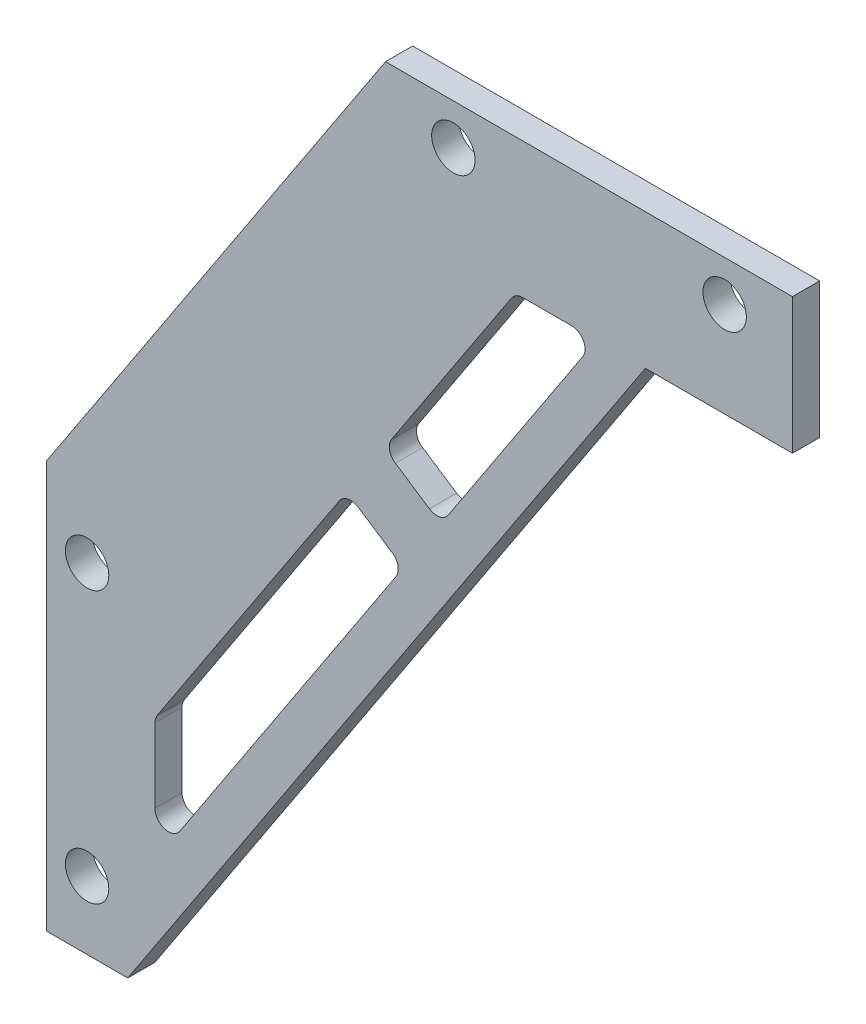
from build123d import *

# Parameters (mm, degrees)
SKETCH_1_R          = 1.6
EXTRUDE_1_DEPTH     = 2
CUT_EXTRUDE_1_DEPTH = 88.4814266


with BuildPart() as part:
    # 草图1 → 凸台-拉伸1 (new body)
    with BuildSketch(Plane.XY):
        Polygon((0, 0), (0, 30), (25, 68), (55, 68), (55, 58), (44.157894737, 58), (6, 0), align=None)
        with Locations((3, 25)):
            Circle(SKETCH_1_R, mode=Mode.SUBTRACT)
        with Locations((3, 5)):
            Circle(SKETCH_1_R, mode=Mode.SUBTRACT)
        with Locations((30, 65)):
            Circle(SKETCH_1_R, mode=Mode.SUBTRACT)
        with Locations((50, 65)):
            Circle(SKETCH_1_R, mode=Mode.SUBTRACT)
    extrude(amount=EXTRUDE_1_DEPTH)

    # 草图2 → 切除-拉伸1 (cut, through all)
    with BuildSketch(Plane.XY.offset(2)):
        with BuildLine():
            Line((35.120951799, 58), (38.711972457, 58))
            ThreePointArc((38.711972457, 58), (39.592204387, 57.474543727), (39.547389539, 56.450383499))
            Line((39.547389539, 56.450383499), (29.621611135, 41.363200325))
            ThreePointArc((29.621611135, 41.363200325), (28.988285582, 40.933450188), (28.236577552, 41.077399744))
            Line((28.236577552, 41.077399744), (25.730326305, 42.726249249))
            ThreePointArc((25.730326305, 42.726249249), (25.300576167, 43.359574802), (25.444525724, 44.111282833))
            Line((25.444525724, 44.111282833), (34.285534717, 57.549616501))
            ThreePointArc((34.285534717, 57.549616501), (34.646408072, 57.88023193), (35.120951799, 58))
        make_face()
        with BuildLine():
            Line((8, 11.837801866), (8, 17.296153265))
            ThreePointArc((8, 17.296153265), (8.042028946, 17.583018145), (8.164582918, 17.845769767))
            Line((8.164582918, 17.845769767), (21.597210214, 38.263363257))
            ThreePointArc((21.597210214, 38.263363257), (22.230535767, 38.693113395), (22.982243798, 38.549163838))
            Line((22.982243798, 38.549163838), (25.488495044, 36.900314333))
            ThreePointArc((25.488495044, 36.900314333), (25.918245182, 36.26698878), (25.774295625, 35.51528075))
            Line((25.774295625, 35.51528075), (9.835417082, 11.288185364))
            ThreePointArc((9.835417082, 11.288185364), (8.713135121, 10.879830812), (8, 11.837801866))
        make_face()
    extrude(amount=-CUT_EXTRUDE_1_DEPTH, mode=Mode.SUBTRACT)


solid = part.part
